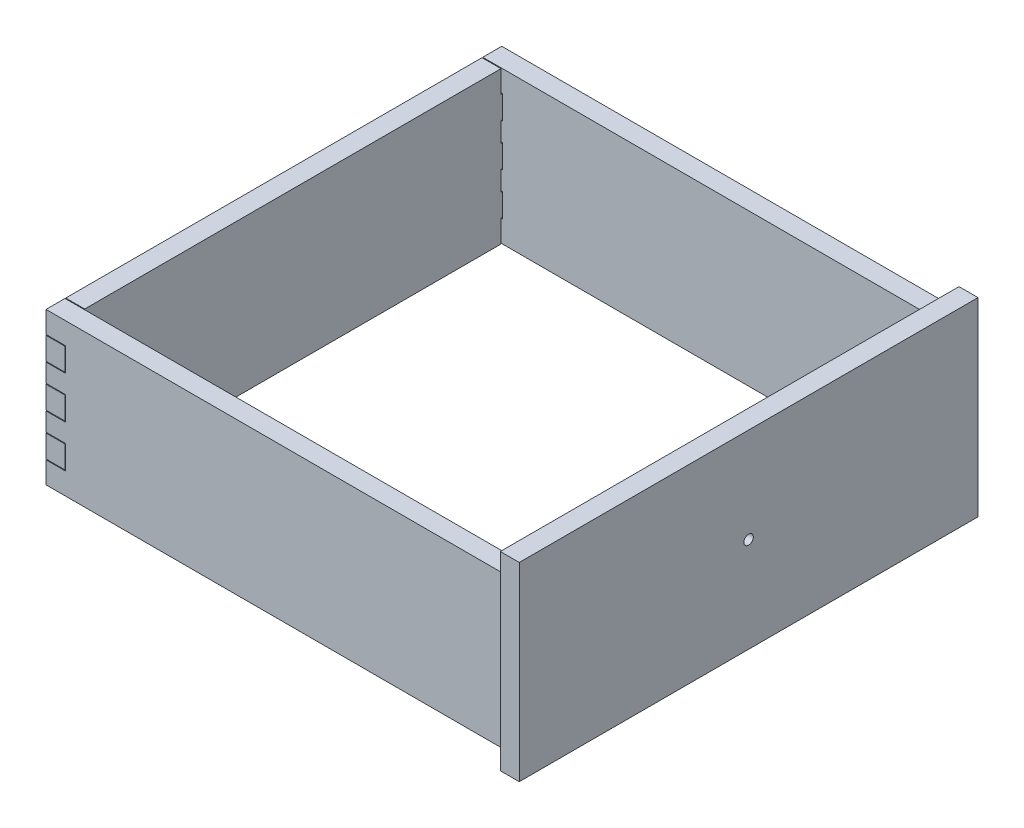
from build123d import *

# Parameters (mm, degrees)
BOSS_EXTRUDE2_DEPTH      = 50.8
BOSS_EXTRUDE3_DEPTH      = 50.8
BOSS_EXTRUDE3_DEPTH_BACK = 50.8
SKETCH1_6_W              = 12.7
SKETCH1_6_H              = 279.4
BOSS_EXTRUDE4_DEPTH      = 50.8
BOSS_EXTRUDE4_DEPTH_BACK = 50.8
SKETCH1_8_W              = 12.7
SKETCH1_8_H              = 306.8
BOSS_EXTRUDE5_DEPTH      = 63.5
SKETCH5_W                = 13.2
SKETCH5_H                = 101.6
CUT_EXTRUDE1_DEPTH       = 0.5
SKETCH6_W                = 13.2
SKETCH6_H                = 16
CUT_EXTRUDE2_DEPTH       = 13.2
LPATTERN1_COUNT          = 3
LPATTERN1_PITCH          = 28.3
SKETCH7_W                = 12.7
SKETCH7_H                = 15
BOSS_EXTRUDE31_DEPTH     = 13.2
LPATTERN2_COUNT          = 3
LPATTERN2_PITCH          = 28.3
SKETCH51_W               = 13.2
SKETCH51_H               = 101.6
CUT_EXTRUDE11_DEPTH      = 0.5
SKETCH61_W               = 13.2
SKETCH61_H               = 16
CUT_EXTRUDE21_DEPTH      = 13.2
LPATTERN11_COUNT         = 3
LPATTERN11_PITCH         = 28.3
SKETCH71_W               = 12.7
SKETCH71_H               = 15
BOSS_EXTRUDE32_DEPTH     = 13.2
LPATTERN21_COUNT         = 3
LPATTERN21_PITCH         = 28.3


with BuildPart() as part:
    # Sketch1 → Boss-Extrude2 (new, symmetric)
    with BuildSketch(Plane(origin=(0, 0, 0), x_dir=(1, 0, 0), z_dir=(0, 1, 0))):
        Polygon((0, -152.4), (0, -139.7), (-292.1, -139.7), (-304.8, -139.7), (-304.8, -152.4), align=None)
    extrude(amount=BOSS_EXTRUDE2_DEPTH, both=True)

    # Sketch6 → Cut-Extrude2 (cut)
    with BuildSketch(Plane.XY.offset(152.4)):
        with Locations((-298.2, -28.3)):
            Rectangle(SKETCH6_W, SKETCH6_H)
    cut_extrude2 = extrude(amount=-CUT_EXTRUDE2_DEPTH, mode=Mode.SUBTRACT)

    # LPattern1: Cut-Extrude2 ×3
    with Locations(*[(0, i * LPATTERN1_PITCH, 0) for i in range(1, LPATTERN1_COUNT)]):
        add(cut_extrude2, mode=Mode.SUBTRACT)


with BuildPart() as body_2:
    # Sketch1<6> → Boss-Extrude3 (new, two sides: drawn at the far end of the back side and taken through both)
    with BuildSketch(Plane(origin=(0, 0, 0), x_dir=(1, 0, 0), z_dir=(0, 1, 0)).offset(-BOSS_EXTRUDE3_DEPTH_BACK)):
        with Locations((-298.45, 0)):
            Rectangle(SKETCH1_6_W, SKETCH1_6_H)
    extrude(amount=BOSS_EXTRUDE3_DEPTH + BOSS_EXTRUDE3_DEPTH_BACK)

    # Sketch5 → Cut-Extrude1 (cut)
    with BuildSketch(Plane.XY.offset(139.7)):
        with Locations((-298.2, 0)):
            Rectangle(SKETCH5_W, SKETCH5_H)
    extrude(amount=-CUT_EXTRUDE1_DEPTH, mode=Mode.SUBTRACT)

    # Sketch7 → Boss-Extrude31 (add)
    with BuildSketch(Plane.XY.offset(152.4)):
        with Locations((-298.45, -28.3)):
            Rectangle(SKETCH7_W, SKETCH7_H)
    boss_extrude31 = extrude(amount=-BOSS_EXTRUDE31_DEPTH)

    # LPattern2: Boss-Extrude31 ×3
    with Locations(*[(0, i * LPATTERN2_PITCH, 0) for i in range(1, LPATTERN2_COUNT)]):
        add(boss_extrude31)

    # Sketch51 → Cut-Extrude11 (cut)
    with BuildSketch(Plane(origin=(0, 0, -139.7), x_dir=(-1, 0, 0), z_dir=(0, 0, -1))):
        with Locations((298.2, 0)):
            Rectangle(SKETCH51_W, SKETCH51_H)
    extrude(amount=-CUT_EXTRUDE11_DEPTH, mode=Mode.SUBTRACT)

    # Sketch71 → Boss-Extrude32 (add)
    with BuildSketch(Plane(origin=(0, 0, -152.4), x_dir=(-1, 0, 0), z_dir=(0, 0, -1))):
        with Locations((298.45, 28.3)):
            Rectangle(SKETCH71_W, SKETCH71_H)
    boss_extrude32 = extrude(amount=-BOSS_EXTRUDE32_DEPTH)

    # LPattern21: Boss-Extrude32 ×3
    with Locations(*[(0, -i * LPATTERN21_PITCH, 0) for i in range(1, LPATTERN21_COUNT)]):
        add(boss_extrude32)


with BuildPart() as body_3:
    # Sketch1<7> → Boss-Extrude4 (new, two sides: drawn at the far end of the back side and taken through both)
    with BuildSketch(Plane(origin=(0, 0, 0), x_dir=(1, 0, 0), z_dir=(0, 1, 0)).offset(-BOSS_EXTRUDE4_DEPTH_BACK)):
        Polygon((0, 139.7), (0, 152.4), (-304.8, 152.4), (-304.8, 139.7), (-292.1, 139.7), align=None)
    extrude(amount=BOSS_EXTRUDE4_DEPTH + BOSS_EXTRUDE4_DEPTH_BACK)

    # Sketch61 → Cut-Extrude21 (cut)
    with BuildSketch(Plane(origin=(0, 0, -152.4), x_dir=(-1, 0, 0), z_dir=(0, 0, -1))):
        with Locations((298.2, 28.3)):
            Rectangle(SKETCH61_W, SKETCH61_H)
    cut_extrude21 = extrude(amount=-CUT_EXTRUDE21_DEPTH, mode=Mode.SUBTRACT)

    # LPattern11: Cut-Extrude21 ×3
    with Locations(*[(0, -i * LPATTERN11_PITCH, 0) for i in range(1, LPATTERN11_COUNT)]):
        add(cut_extrude21, mode=Mode.SUBTRACT)


with BuildPart() as body_4:
    # Sketch1<8> → Boss-Extrude5 (new, symmetric)
    with BuildSketch(Plane(origin=(0, 0, 0), x_dir=(1, 0, 0), z_dir=(0, 1, 0))):
        with Locations((6.35, 0)):
            Rectangle(SKETCH1_8_W, SKETCH1_8_H)
    extrude(amount=BOSS_EXTRUDE5_DEPTH, both=True)

    # Sketch913 → 1/4 (0.25) Diameter Hole1 (revolve, cut)
    with BuildSketch(Plane(origin=(12.7, 0, 0), x_dir=(0, 0, -1), z_dir=(0, 1, 0))):
        Polygon((0, 0), (0, 27.307732465), (3.175, 25.4), (3.175, 0), align=None)
    revolve(axis=Axis((19.05, 0, 0), (-1, 0, 0)), mode=Mode.SUBTRACT)


solid = Compound([part.part, body_2.part, body_3.part, body_4.part])
